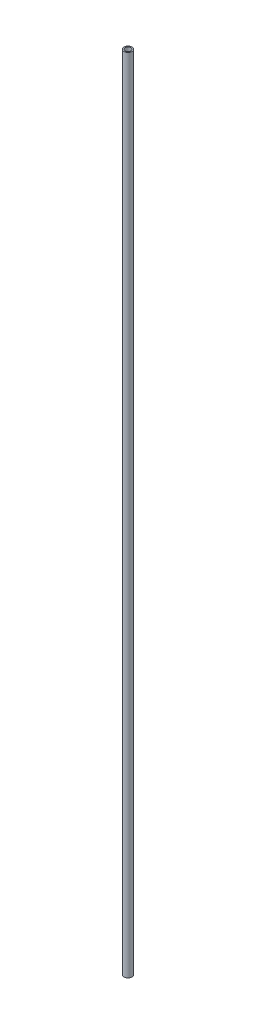
from build123d import *

# Parameters (mm, degrees)
SKETCH1_R           = 9.5
SKETCH1_R_2         = 6.9
BOSS_EXTRUDE1_DEPTH = 1930


with BuildPart() as part:
    # Sketch1 → Boss-Extrude1 (new body)
    with BuildSketch(Plane(origin=(0, 0, 0), x_dir=(1, 0, 0), z_dir=(0, 1, 0))):
        with Locations(Location((0, 0, 0), (0, 0, 270))):
            Circle(SKETCH1_R)
        with Locations(Location((0, 0, 0), (0, 0, 270))):
            Circle(SKETCH1_R_2, mode=Mode.SUBTRACT)
    extrude(amount=BOSS_EXTRUDE1_DEPTH)


solid = part.part
